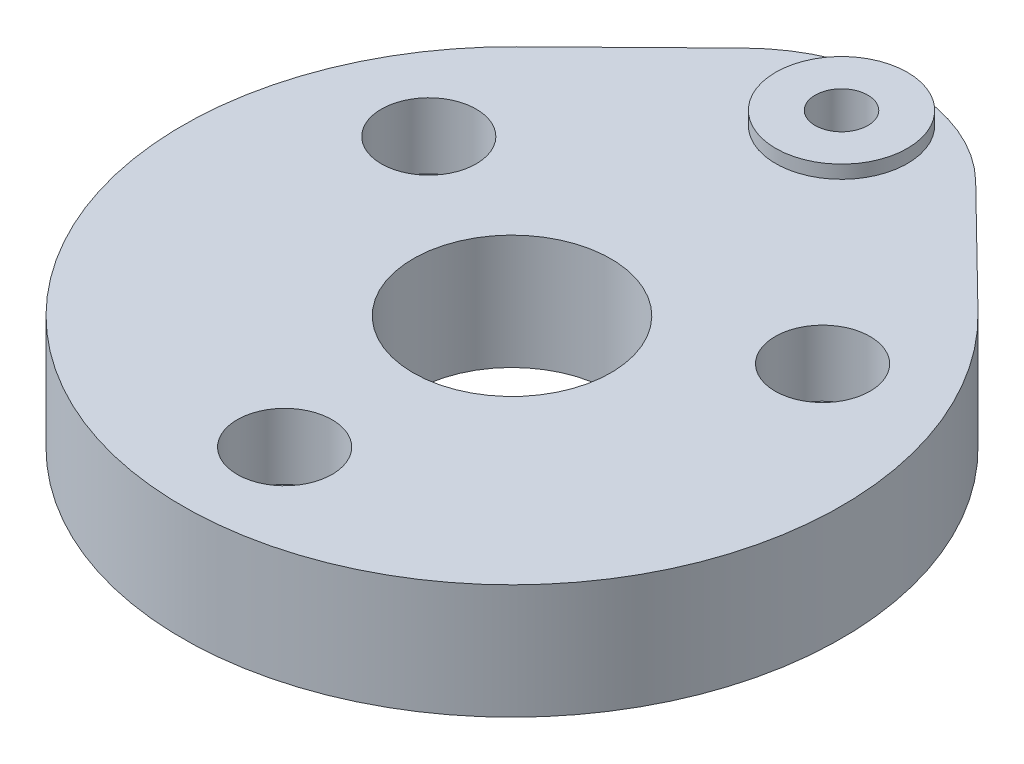
from build123d import *

# Parameters (mm, degrees)
SKETCH_1_R          = 25
SKETCH_1_R_2        = 1.9
SKETCH_1_R_3        = 7.5
EXTRUDE_1_DEPTH     = 8.7
SKETCH_2_R          = 3.6
CUT_EXTRUDE_1_DEPTH = 5
EXTRUDE_START       = -8.7
EXTRUDE_4_DEPTH     = 8.7
SKETCH_14_R         = 2
CUT_EXTRUDE_5_DEPTH = 41.00862407
EXTRUDE_START_2     = 1
SKETCH_15_R         = 5
SKETCH_15_R_2       = 2
EXTRUDE_5_DEPTH     = 1
SKETCH_19_R         = 3.75
CUT_EXTRUDE_7_DEPTH = 2.7


with BuildPart() as part:
    # 草图1 → 凸台-拉伸1 (new body)
    with BuildSketch(Plane(origin=(0, 0, 0), x_dir=(1, 0, 0), z_dir=(0, 1, 0))):
        with Locations(Location((0, 0, 0), (0, 0, 270))):
            Circle(SKETCH_1_R)
        with Locations(Location((14.938938215, 8.625, 0), (0, 0, 270))):
            Circle(SKETCH_1_R_2, mode=Mode.SUBTRACT)
        with Locations(Location((0, -17.25, 0), (0, 0, 270))):
            Circle(SKETCH_1_R_2, mode=Mode.SUBTRACT)
        with Locations(Location((-14.938938215, 8.625, 0), (0, 0, 270))):
            Circle(SKETCH_1_R_2, mode=Mode.SUBTRACT)
        with Locations(Location((0, 0, 0), (0, 0, 270))):
            Circle(SKETCH_1_R_3, mode=Mode.SUBTRACT)
    extrude(amount=EXTRUDE_1_DEPTH)

    # 草图2 → 切除-拉伸1 (cut)
    with BuildSketch(Plane(origin=(0, 8.7, 0), x_dir=(1, 0, 0), z_dir=(0, 1, 0))):
        with Locations(Location((0, -17.25, 0), (0, 0, 270))):
            Circle(SKETCH_2_R)
        with Locations(Location((-14.938938215, 8.625, 0), (0, 0, 270))):
            Circle(SKETCH_2_R)
        with Locations(Location((14.938938215, 8.625, 0), (0, 0, 270))):
            Circle(SKETCH_2_R)
    extrude(amount=-CUT_EXTRUDE_1_DEPTH, mode=Mode.SUBTRACT)

    # 草图13 → 凸台-拉伸4 (add)
    with BuildSketch(Plane(origin=(0, 8.7, 0), x_dir=(1, 0, 0), z_dir=(0, 1, 0)).offset(EXTRUDE_START)):
        with BuildLine():
            Line((-8.748177653, 26.428571429), (-17.496355306, 17.857142857))
            ThreePointArc((-17.496355306, 17.857142857), (0, 25), (17.496355306, 17.857142857))
            Line((17.496355306, 17.857142857), (8.748177653, 26.428571429))
            ThreePointArc((8.748177653, 26.428571429), (0, 30), (-8.748177653, 26.428571429))
        make_face()
    extrude(amount=EXTRUDE_4_DEPTH)

    # 草图14 → 切除-拉伸5 (cut, through all)
    with BuildSketch(Plane(origin=(0, 8.7, 0), x_dir=(1, 0, 0), z_dir=(0, 1, 0))):
        with Locations(Location((0, 25, 0), (0, 0, 270))):
            Circle(SKETCH_14_R)
    extrude(amount=-CUT_EXTRUDE_5_DEPTH, mode=Mode.SUBTRACT)

    # 草图15 → 凸台-拉伸5 (add)
    with BuildSketch(Plane(origin=(0, 8.7, 0), x_dir=(1, 0, 0), z_dir=(0, 1, 0)).offset(EXTRUDE_START_2)):
        with Locations(Location((0, 25, 0), (0, 0, 89.99953218))):
            Circle(SKETCH_15_R)
        with Locations(Location((0, 25, 0), (0, 0, 270))):
            Circle(SKETCH_15_R_2, mode=Mode.SUBTRACT)
    extrude(amount=-EXTRUDE_5_DEPTH)

    # 草图19 → 切除-拉伸7 (cut)
    with BuildSketch(Plane.XZ):
        with Locations(Location((0, -25, 0), (0, 0, 270))):
            Circle(SKETCH_19_R)
    extrude(amount=-CUT_EXTRUDE_7_DEPTH, mode=Mode.SUBTRACT)


solid = part.part
